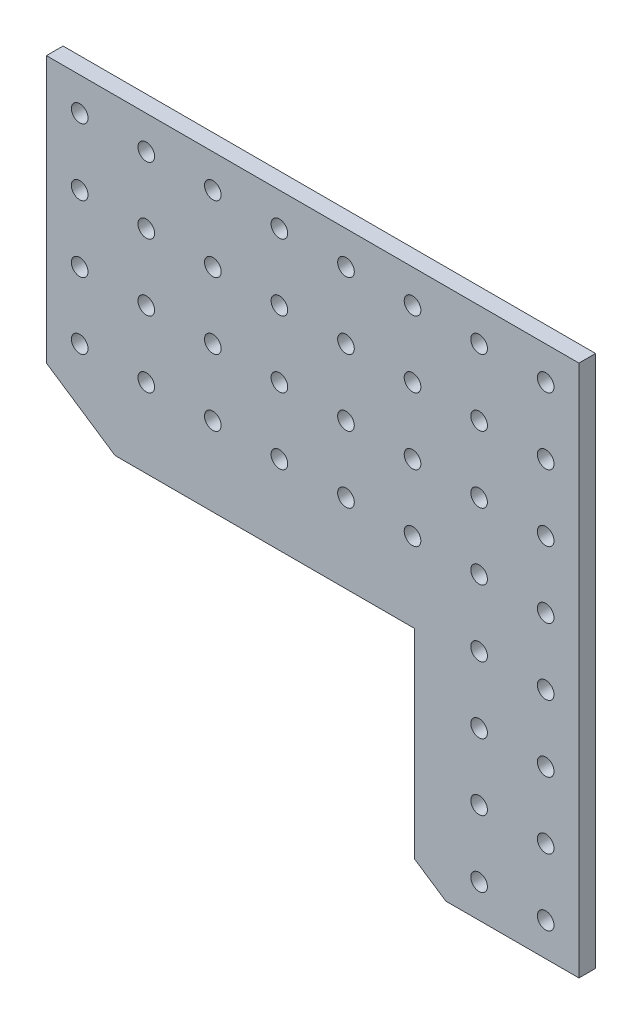
from build123d import *

# Parameters (mm, degrees)
EXTRUSION1_DEPTH   = 6.35
HOLE1_D            = 6.35
EXTRUSION2_DEPTH   = 25.4
SKETCH5_W          = 38.1
SKETCH5_H          = 84.141733333
CUT_EXTRUDE1_DEPTH = 230.421522185


with BuildPart() as part:
    # Sketch1 → Extrusion1 (new body)
    with BuildSketch(Plane.XY):
        Polygon((-136.071428881, 83.003571429), (16.328571119, -18.596428571), (67.128571119, -18.596428571), (67.128571119, 184.603571429), (-136.071428881, 184.603571429), align=None)
    extrude(amount=EXTRUSION1_DEPTH)

    # Hole1 (through all)
    with Locations(Plane.XY.offset(6.35)):
        with Locations((-123.371428881, 171.903571429), (-97.971428881, 171.903571429), (-72.571428881, 171.903571429), (-47.171428881, 171.903571429), (-21.771428881, 171.903571429), (3.628571119, 171.903571429), (29.028571119, 171.903571429), (54.428571119, 171.903571429), (-123.371428881, 146.503571429), (-97.971428881, 146.503571429), (-72.571428881, 146.503571429), (-47.171428881, 146.503571429), (-21.771428881, 146.503571429), (3.628571119, 146.503571429), (29.028571119, 146.503571429), (54.428571119, 146.503571429), (-123.371428881, 121.103571429), (-97.971428881, 121.103571429), (-72.571428881, 121.103571429), (-47.171428881, 121.103571429), (-21.771428881, 121.103571429), (3.628571119, 121.103571429), (29.028571119, 121.103571429), (54.428571119, 121.103571429), (-123.371428881, 95.703571429), (-97.971428881, 95.703571429), (-72.571428881, 95.703571429), (-47.171428881, 95.703571429), (-21.771428881, 95.703571429), (3.628571119, 95.703571429), (29.028571119, 95.703571429), (54.428571119, 95.703571429), (54.428571119, 70.303571429), (54.428571119, 44.903571429), (54.428571119, 19.503571429), (54.428571119, -5.896428571), (29.028571119, 70.303571429), (29.028571119, 44.903571429), (29.028571119, 19.503571429), (29.028571119, -5.896428571)):
            Hole(HOLE1_D / 2)

    # Sketch4 → Extrusion2 (cut)
    with BuildSketch(Plane(origin=(0, 0, 0), x_dir=(-1, 0, 0), z_dir=(0, 0, -1))):
        Polygon((33.684028881, 65.545304762), (33.684028881, 14.745304762), (109.884028881, 65.545304762), align=None)
    extrude(amount=-EXTRUSION2_DEPTH, mode=Mode.SUBTRACT)

    # Sketch5 → Cut-Extrude1 (cut, through all)
    with BuildSketch(Plane.XY.offset(6.35)):
        with Locations((-14.634028881, 23.474438095)):
            Rectangle(SKETCH5_W, SKETCH5_H)
    extrude(amount=-CUT_EXTRUDE1_DEPTH, mode=Mode.SUBTRACT)


solid = part.part
